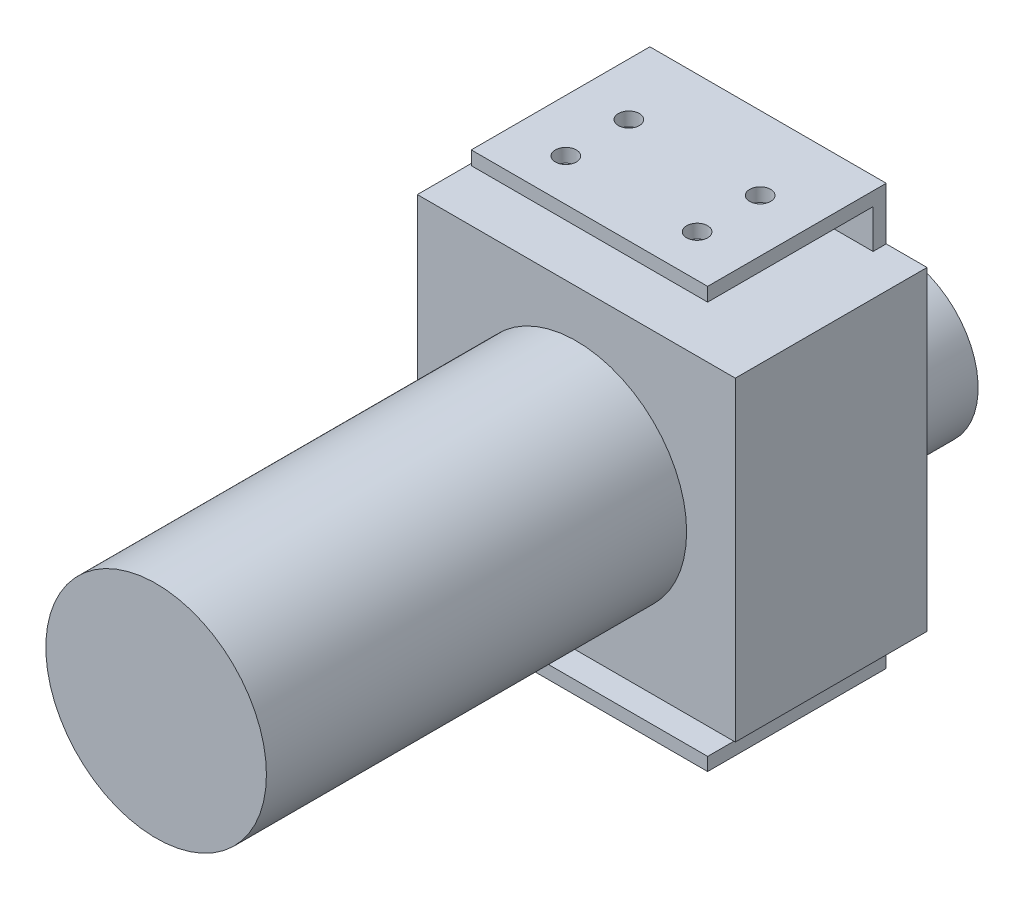
from build123d import *

# Parameters (mm, degrees)
BOSS_EXTRUDE1_DEPTH = 2.5
SKETCH3_W           = 45
SKETCH3_H           = 2.5
SKETCH3_H_2         = 2.602594336
BOSS_EXTRUDE2_DEPTH = 31.5
SKETCH4_W           = 60.536099416
SKETCH4_H           = 60
BOSS_EXTRUDE3_DEPTH = 34
SKETCH5_R           = 21
BOSS_EXTRUDE4_DEPTH = 80
SKETCH6_R           = 4
BOSS_EXTRUDE5_DEPTH = 3
SKETCH7_R           = 15
BOSS_EXTRUDE6_DEPTH = 22
SKETCH13_R          = 2
CUT_EXTRUDE1_DEPTH  = 3
CUT_EXTRUDE2_START  = -3
SKETCH14_R          = 2
CUT_EXTRUDE2_DEPTH  = 3


with BuildPart() as part:
    # Sketch2 → Boss-Extrude1 (new body)
    with BuildSketch(Plane.XY):
        Polygon((-30.268049708, -30), (-30.268049708, 30), (-22.5, 30), (-22.5, 40), (22.5, 40), (22.5, 30), (30.268049708, 30), (30.268049708, -30), (22.5, -30), (22.5, -40), (-22.5, -40), (-22.5, -30), align=None)
    extrude(amount=BOSS_EXTRUDE1_DEPTH)

    # Sketch3 → Boss-Extrude2 (add)
    with BuildSketch(Plane.XY.offset(2.5)):
        with Locations((0, -38.75)):
            Rectangle(SKETCH3_W, SKETCH3_H)
        with Locations((0, 38.698702832)):
            Rectangle(SKETCH3_W, SKETCH3_H_2)
    extrude(amount=BOSS_EXTRUDE2_DEPTH)

    # Sketch4 → Boss-Extrude3 (add)
    with BuildSketch(Plane.XY.offset(2.5)):
        Rectangle(SKETCH4_W, SKETCH4_H)
    extrude(amount=BOSS_EXTRUDE3_DEPTH)

    # Sketch5 → Boss-Extrude4 (add)
    with BuildSketch(Plane.XY.offset(36.5)):
        Circle(SKETCH5_R)
    extrude(amount=BOSS_EXTRUDE4_DEPTH)

    # Sketch6 → Boss-Extrude5 (add)
    with BuildSketch(Plane(origin=(0, 0, 0), x_dir=(-1, 0, 0), z_dir=(0, 0, -1))):
        with Locations((0, -10)):
            Circle(SKETCH6_R)
    extrude(amount=BOSS_EXTRUDE5_DEPTH)

    # Sketch7 → Boss-Extrude6 (add)
    with BuildSketch(Plane(origin=(0, 0, -3), x_dir=(-1, 0, 0), z_dir=(0, 0, -1))):
        with Locations((0, -10)):
            Circle(SKETCH7_R)
    extrude(amount=BOSS_EXTRUDE6_DEPTH)

    # Sketch13 → Cut-Extrude1 (cut)
    with BuildSketch(Plane(origin=(0, 40, 0), x_dir=(1, 0, 0), z_dir=(0, 1, 0))):
        with Locations(Location((-12.5, -14, 0), (0, 0, 270))):
            Circle(SKETCH13_R)
        with Locations(Location((12.5, -14, 0), (0, 0, 270))):
            Circle(SKETCH13_R)
        with Locations(Location((-12.5, -26, 0), (0, 0, 270))):
            Circle(SKETCH13_R)
        with Locations(Location((12.5, -26, 0), (0, 0, 270))):
            Circle(SKETCH13_R)
    extrude(amount=-CUT_EXTRUDE1_DEPTH, mode=Mode.SUBTRACT)

    # Sketch14 → Cut-Extrude2 (cut)
    with BuildSketch(Plane.XZ.offset(40).offset(CUT_EXTRUDE2_START)):
        with Locations(Location((12.5, 26, 0), (0, 0, 90))):
            Circle(SKETCH14_R)
        with Locations(Location((12.5, 14, 0), (0, 0, 90))):
            Circle(SKETCH14_R)
        with Locations(Location((-12.5, 14, 0), (0, 0, 90))):
            Circle(SKETCH14_R)
        with Locations(Location((-12.5, 26, 0), (0, 0, 90))):
            Circle(SKETCH14_R)
    extrude(amount=CUT_EXTRUDE2_DEPTH, mode=Mode.SUBTRACT)


solid = part.part
